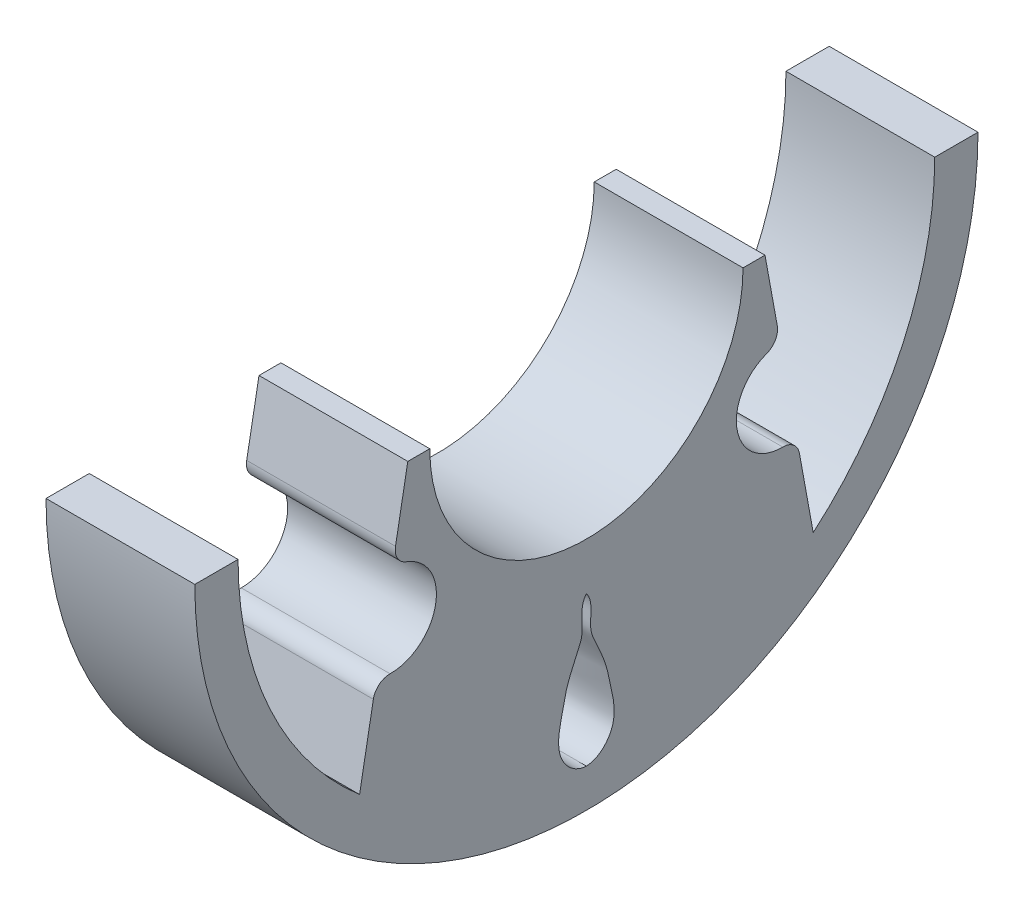
from build123d import *

# Parameters (mm, degrees)
BOSS_EXTRUDE1_DEPTH = 38


with BuildPart() as part:
    # Sketch1 → Boss-Extrude1 (new body)
    with BuildSketch(Plane(origin=(0, 0, 0), x_dir=(0, -1, 0), z_dir=(-1, 0, 0))):
        with BuildLine():
            Line((17.209546758, 48.747753074), (0, 45.608021319))
            Line((0, 45.608021319), (0, 40))
            ThreePointArc((0, 40), (40, 0), (0, -40))
            Line((0, -40), (0, -45.608021319))
            Line((0, -45.608021319), (17.209546758, -48.747753074))
            ThreePointArc((17.209546758, -48.747753074), (20.107264785, -48.24985544), (22.000023251, -45.999936061))
            ThreePointArc((22.000023251, -45.999936061), (35.10074516, -38.485362803), (44.70383792, -50.142049092))
            ThreePointArc((44.70383792, -50.142049092), (45.680143747, -52.915404235), (48.215353578, -54.404492187))
            Line((48.215353578, -54.404492187), (67.510876588, -57.924792122))
            ThreePointArc((67.510876588, -57.924792122), (37.150353432, -80.826055452), (0, -88.955044826))
            Line((0, -88.955044826), (0, -100))
            ThreePointArc((0, -100), (100, 0), (0, 100))
            Line((0, 100), (0, 88.955044826))
            ThreePointArc((0, 88.955044826), (37.150353432, 80.826055452), (67.510876588, 57.924792122))
            Line((67.510876588, 57.924792122), (48.215353578, 54.404492187))
            ThreePointArc((48.215353578, 54.404492187), (45.680143747, 52.915404235), (44.70383792, 50.142049092))
            ThreePointArc((44.70383792, 50.142049092), (35.10074516, 38.485362803), (22.000023251, 45.999936061))
            ThreePointArc((22.000023251, 45.999936061), (20.107264785, 48.24985544), (17.209546758, 48.747753074))
        make_face()
        with BuildLine():
            add(Edge.make_bspline(
                [(52, 0), (55.06830649, 2.314828746), (58.844383808, 0.214472049), (65.537828774, 2.925828908), (68.845366533, 4.841132392), (75.905131868, 6.165625008), (79.446058218, 7.457393158), (86.674587248, 6.527455746), (90.026510297, 3.61430509), (90.191479957, 0)],
                knots=[0, 0, 0, 0, 0.25, 0.25, 0.5, 0.5, 0.75, 0.75, 1, 1, 1, 1], degree=3))
            add(Edge.make_bspline(
                [(90.191479957, 0), (90.026510297, -3.61430509), (86.674587248, -6.527455746), (79.446058218, -7.457393158), (75.905131868, -6.165625008), (68.845366533, -4.841132392), (65.537828774, -2.925828908), (58.844383808, -0.214472049), (55.06830649, -2.314828746), (52, 0)],
                knots=[0, 0, 0, 0, 0.25, 0.25, 0.5, 0.5, 0.75, 0.75, 1, 1, 1, 1], degree=3))
        make_face(mode=Mode.SUBTRACT)
    extrude(amount=-BOSS_EXTRUDE1_DEPTH)


solid = part.part
